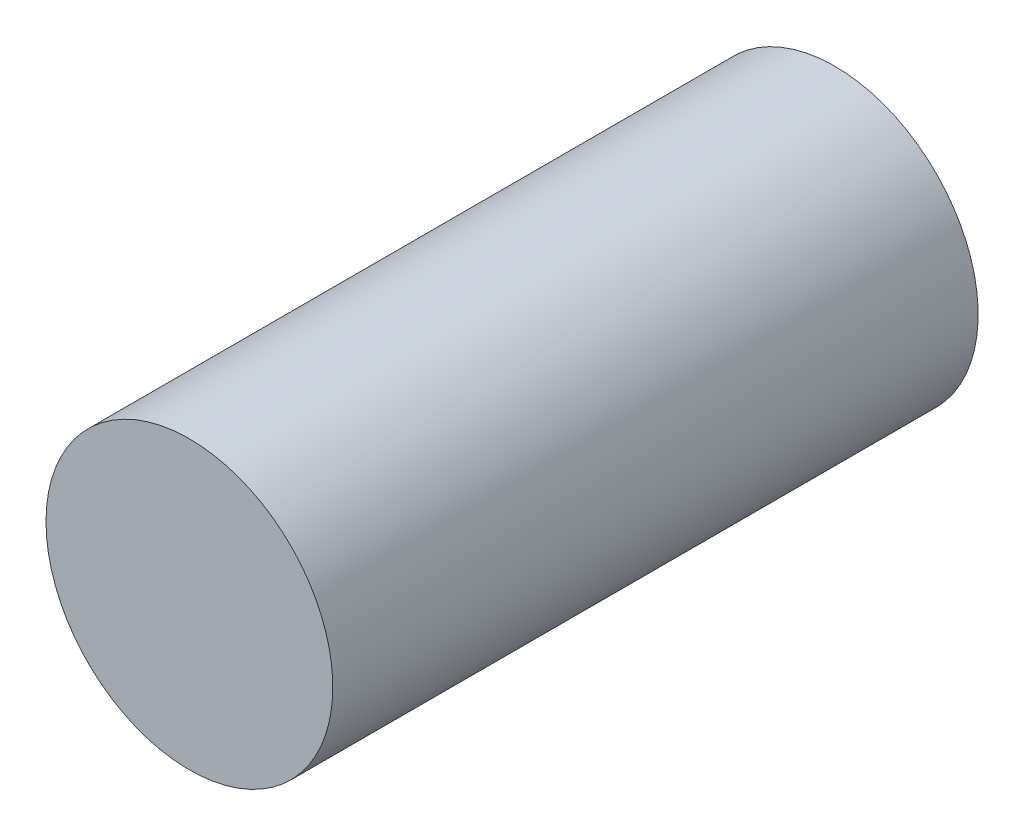
from build123d import *

# Parameters (mm, degrees)
SKETCH1_R           = 5
BOSS_EXTRUDE1_DEPTH = 22.5


with BuildPart() as part:
    # Sketch1 → Boss-Extrude1 (new body)
    with BuildSketch(Plane.XY):
        with Locations(Location((0, 0, 0), (0, 0, 180))):
            Circle(SKETCH1_R)
    extrude(amount=BOSS_EXTRUDE1_DEPTH)


solid = part.part
